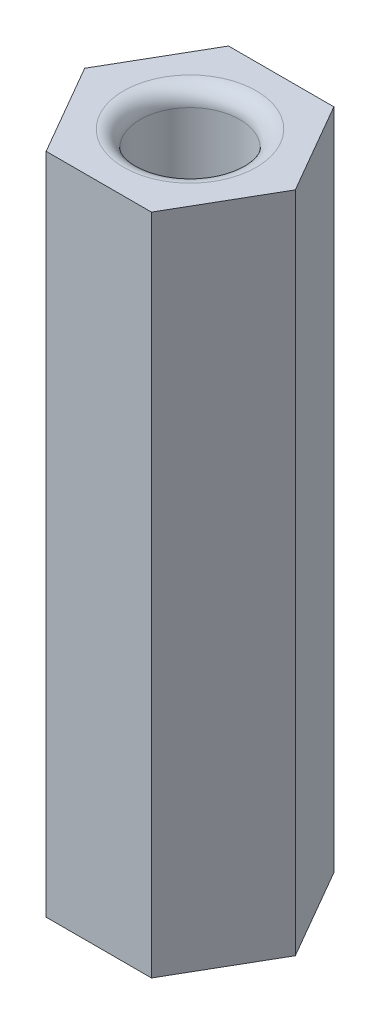
from build123d import *

# Parameters (mm, degrees)
SKETCH1_R           = 1.5
BOSS_EXTRUDE1_DEPTH = 20
FILLET1_R           = 0.5


with BuildPart() as part:
    # Sketch1 → Boss-Extrude1 (new body)
    with BuildSketch(Plane(origin=(0, 0, 0), x_dir=(1, 0, 0), z_dir=(0, 1, 0))):
        Polygon((-3.175426481, 0), (-1.58771324, -2.75), (1.58771324, -2.75), (3.175426481, 0), (1.58771324, 2.75), (-1.58771324, 2.75), align=None)
        with Locations(Location((0, 0, 0), (0, 0, 270))):
            Circle(SKETCH1_R, mode=Mode.SUBTRACT)
    extrude(amount=BOSS_EXTRUDE1_DEPTH)

    # Fillet1
    fillet1_edges = [part.edges().sort_by_distance(p)[0] for p in [
        (0, 0, -1.5),
        (0, 20, -1.5),
    ]]
    fillet(fillet1_edges, radius=FILLET1_R)


solid = part.part
